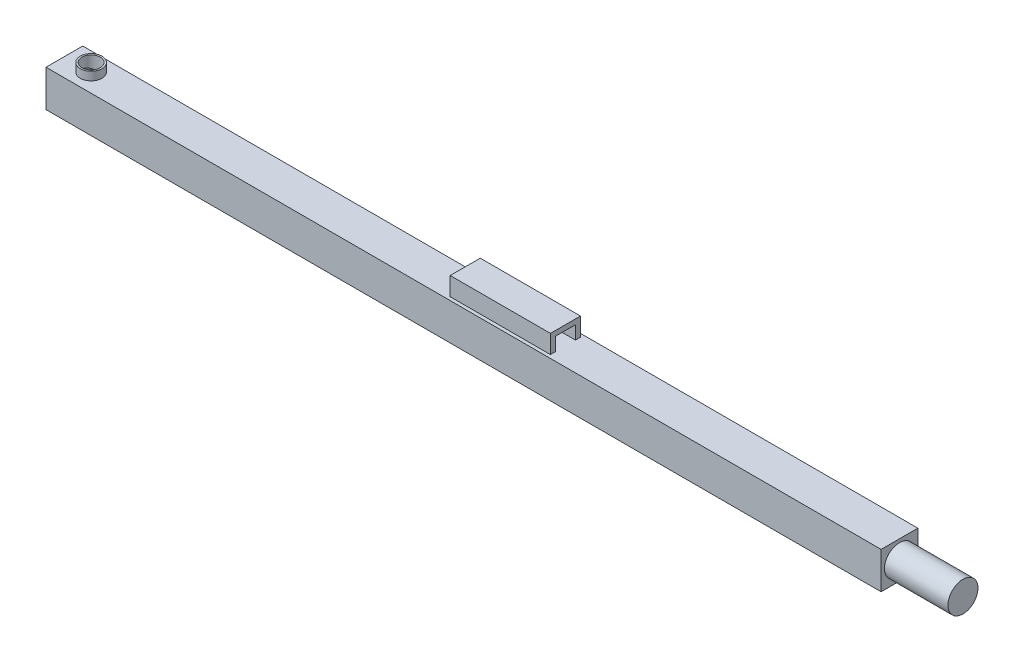
from build123d import *

# Parameters (mm, degrees)
SKETCH1_R               = 4.5
BOSS_EXTRUDE1_DEPTH     = 19
SKETCH2_W               = 11
SKETCH2_H               = 11
BOSS_EXTRUDE2_DEPTH     = 250
SKETCH3_R               = 4.85
CUT_EXTRUDE2_DEPTH      = 19.5
BOSS_EXTRUDE3_START     = -100
BOSS_EXTRUDE3_DEPTH     = 30
CUT_EXTRUDE3_REACH      = 252.302
CUT_EXTRUDE3_END_RADIUS = 4.85
SKETCH5_R               = 2.75
BOSS_EXTRUDE4_START     = 2.5
SKETCH5_3_R             = 3.25
SKETCH5_3_R_2           = 2.75
BOSS_EXTRUDE4_DEPTH     = 2.5


with BuildPart() as part:
    # Sketch1 → Boss-Extrude1 (new body)
    with BuildSketch(Plane(origin=(0, 0, 0), x_dir=(0, 0, -1), z_dir=(1, 0, 0))):
        Circle(SKETCH1_R)
    extrude(amount=BOSS_EXTRUDE1_DEPTH)

    # Sketch2 → Boss-Extrude2 (add)
    with BuildSketch(Plane(origin=(0, 0, 0), x_dir=(0, 0, -1), z_dir=(1, 0, 0))):
        Rectangle(SKETCH2_W, SKETCH2_H)
    extrude(amount=-BOSS_EXTRUDE2_DEPTH)

    # Sketch3 → Cut-Extrude2 (cut)
    with BuildSketch(Plane.ZY.offset(250)):
        Circle(SKETCH3_R)
    extrude(amount=-CUT_EXTRUDE2_DEPTH, mode=Mode.SUBTRACT)

    # Sketch4 → Boss-Extrude3 (add)
    with BuildSketch(Plane(origin=(0, 0, 0), x_dir=(0, 0, -1), z_dir=(1, 0, 0)).offset(BOSS_EXTRUDE3_START)):
        Polygon((-4.5, 11), (4.5, 11), (4.5, 5.5), (3, 5.5), (3, 9.5), (-3, 9.5), (-3, 5.5), (-4.5, 5.5), align=None)
    extrude(amount=-BOSS_EXTRUDE3_DEPTH)

    # Cut-Extrude3: up to this cylinder (the profile starts outside it)
    cut_extrude3_end = Plane(origin=(-242, 0, 0), z_dir=(-1, 0, 0)) * Cylinder(CUT_EXTRUDE3_END_RADIUS, 515.304, mode=Mode.PRIVATE)
    # Sketch5 → Cut-Extrude3 (cut, up to the surface)
    with BuildSketch(Plane(origin=(0, 5.5, 0), x_dir=(1, 0, 0), z_dir=(0, 1, 0)), mode=Mode.PRIVATE) as cut_extrude3_sk1:
        with Locations((-242, 0)):
            Circle(SKETCH5_R)
    cut_extrude3_tool1 = extrude(cut_extrude3_sk1.sketch, amount=-CUT_EXTRUDE3_REACH, mode=Mode.PRIVATE) - cut_extrude3_end
    add(cut_extrude3_tool1.solids().sort_by_distance((-242, 5.5, 0))[0], mode=Mode.SUBTRACT)

    # Sketch5<3> → Boss-Extrude4 (add)
    with BuildSketch(Plane(origin=(0, 5.5, 0), x_dir=(1, 0, 0), z_dir=(0, 1, 0)).offset(BOSS_EXTRUDE4_START)):
        with Locations((-242, 0)):
            Circle(SKETCH5_3_R)
        with Locations((-242, 0)):
            Circle(SKETCH5_3_R_2, mode=Mode.SUBTRACT)
    extrude(amount=-BOSS_EXTRUDE4_DEPTH)


solid = part.part
